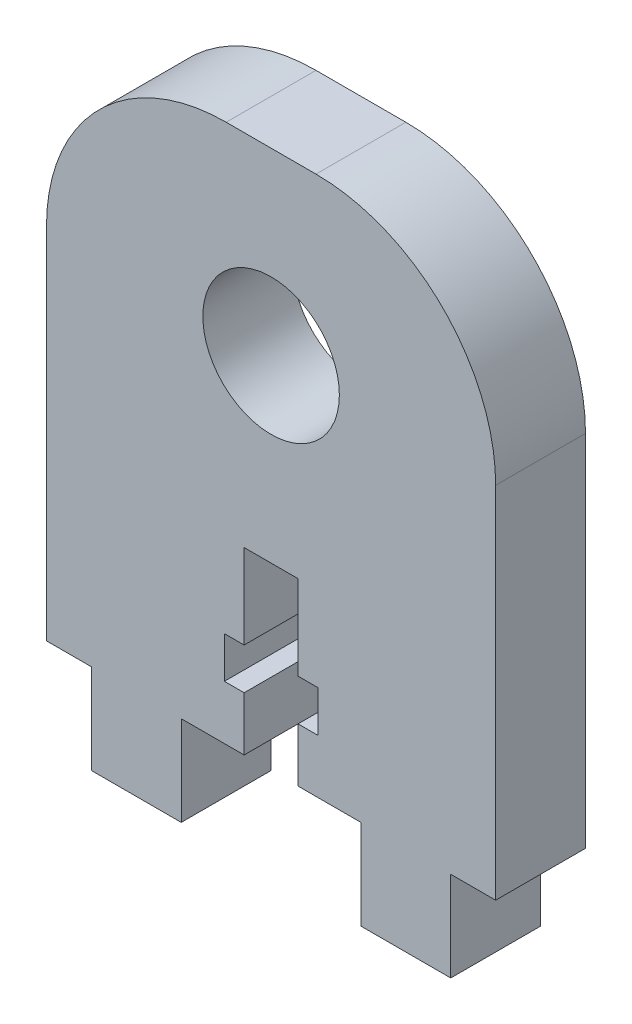
from build123d import *

# Parameters (mm, degrees)
SKETCH1_R           = 3.8
BOSS_EXTRUDE1_DEPTH = 5
FILLET1_R           = 10


with BuildPart() as part:
    # Sketch1 → Boss-Extrude1 (new body)
    with BuildSketch(Plane.XY):
        Polygon((-12.5, 15), (-12.5, -15), (-10, -15), (-10, -20), (-5, -20), (-5, -15), (-1.5, -15), (-1.5, -12), (-2.6, -12), (-2.6, -9.7), (-1.5, -9.7), (-1.5, -5), (1.5, -5), (1.5, -9.7), (2.6, -9.7), (2.6, -12), (1.5, -12), (1.5, -15), (5, -15), (5, -20), (10, -20), (10, -15), (12.5, -15), (12.5, 15), align=None)
        with Locations((0, 5)):
            Circle(SKETCH1_R, mode=Mode.SUBTRACT)
    extrude(amount=BOSS_EXTRUDE1_DEPTH)

    # Fillet1
    fillet1_edges = [part.edges().sort_by_distance(p)[0] for p in [
        (-12.5, 15, 2.5),
        (12.5, 15, 2.5),
    ]]
    fillet(fillet1_edges, radius=FILLET1_R)


solid = part.part
